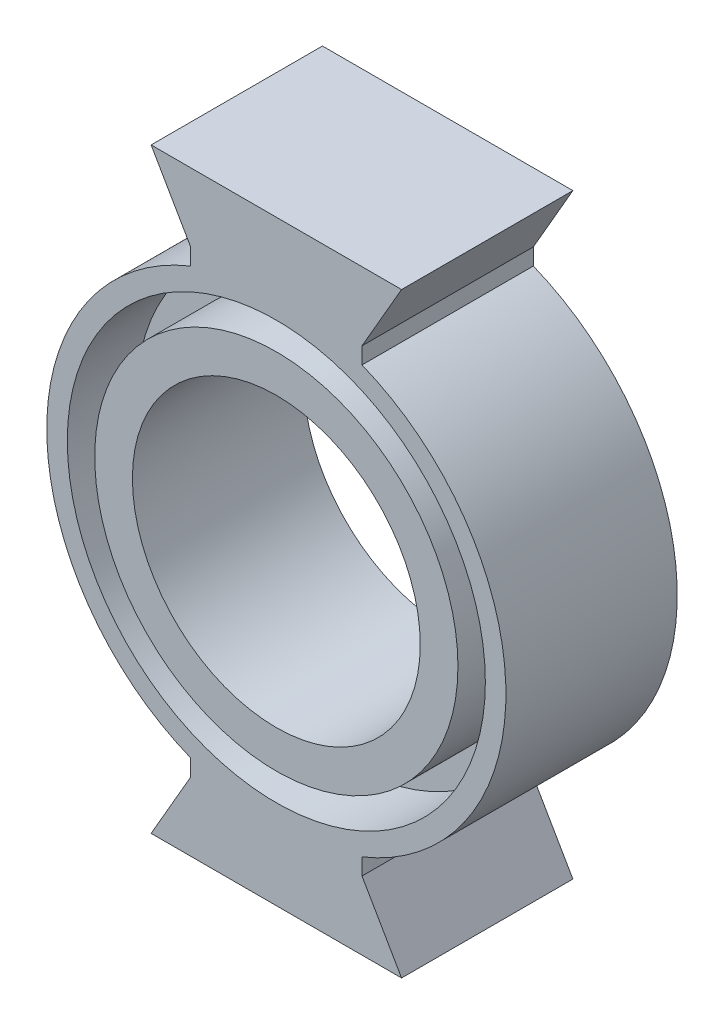
from build123d import *

# Parameters (mm, degrees)
SKETCH1_R           = 8.509
SKETCH1_R_2         = 5.334
BOSS_EXTRUDE1_DEPTH = 6.35
SKETCH2_R           = 7.747
SKETCH2_R_2         = 6.731
CUT_EXTRUDE1_DEPTH  = 2.54
BOSS_EXTRUDE2_DEPTH = 6.35


with BuildPart() as part:
    # Sketch1 → Boss-Extrude1 (new body)
    with BuildSketch(Plane.XY):
        Circle(SKETCH1_R)
        Circle(SKETCH1_R_2, mode=Mode.SUBTRACT)
    extrude(amount=BOSS_EXTRUDE1_DEPTH)

    # Sketch2 → Cut-Extrude1 (cut)
    with BuildSketch(Plane.XY.offset(6.35)):
        Circle(SKETCH2_R)
        Circle(SKETCH2_R_2, mode=Mode.SUBTRACT)
    cut_extrude1 = extrude(amount=-CUT_EXTRUDE1_DEPTH, mode=Mode.SUBTRACT)

    # Sketch3 → Boss-Extrude2 (add)
    with BuildSketch(Plane.XY):
        with BuildLine():
            Line((-3.175, 7.894457296), (-3.175, 8.509))
            Line((-3.175, 8.509), (-4.641469684, 11.049))
            Line((-4.641469684, 11.049), (4.641469684, 11.049))
            Line((4.641469684, 11.049), (3.175, 8.509))
            Line((3.175, 8.509), (3.175, 7.894457296))
            ThreePointArc((3.175, 7.894457296), (0, 8.509), (-3.175, 7.894457296))
        make_face()
    boss_extrude2 = extrude(amount=BOSS_EXTRUDE2_DEPTH)

    # Mirror1: Boss-Extrude2 across plane
    add(boss_extrude2.mirror(Plane.ZX))

    # Mirror2: Cut-Extrude1 across plane
    add(cut_extrude1.mirror(Plane(origin=(0, 0, 3.175), x_dir=(1, 0, 0), z_dir=(0, 0, -1))), mode=Mode.SUBTRACT)


solid = part.part
